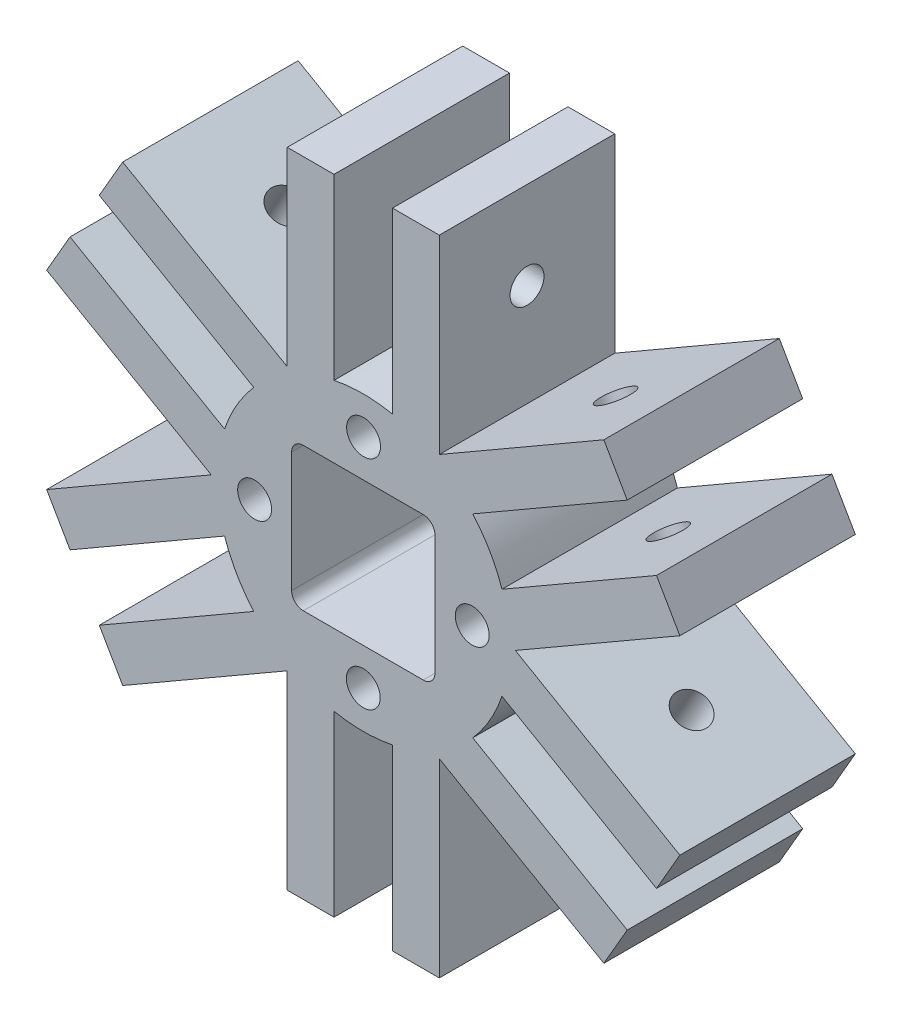
from build123d import *

# Parameters (mm, degrees)
SKETCH1_R           = 12.5
BOSS_EXTRUDE1_DEPTH = 7.5
SKETCH4_W           = 4
SKETCH4_H           = 27.5
BOSS_EXTRUDE3_DEPTH = 15
CIRPATTERN7_COUNT   = 6
SKETCH7_R           = 1.45
CUT_EXTRUDE2_DEPTH  = 17
CIRPATTERN9_COUNT   = 6
CUT_EXTRUDE3_REACH  = 43.398
SKETCH8_W           = 12.25
SKETCH8_H           = 12.25
SKETCH9_R           = 1.45
CUT_EXTRUDE4_DEPTH  = 10
FILLET1_R           = 1


with BuildPart() as part:
    # Sketch1 → Boss-Extrude1 (new, symmetric)
    with BuildSketch(Plane.XY):
        Circle(SKETCH1_R)
    extrude(amount=BOSS_EXTRUDE1_DEPTH, both=True)

    # Sketch4 → Boss-Extrude3 (add)
    with BuildSketch(Plane.XY.offset(7.5)):
        with Locations((-4.5, 13.75)):
            Rectangle(SKETCH4_W, SKETCH4_H)
        with Locations((4.5, 13.75)):
            Rectangle(SKETCH4_W, SKETCH4_H)
    boss_extrude3 = extrude(amount=-BOSS_EXTRUDE3_DEPTH)

    # CirPattern7: Boss-Extrude3 ×6 about axis
    cirpattern7_axis = Axis((0, 0, 0), (0, 0, 1))
    for i in range(1, CIRPATTERN7_COUNT):
        add(boss_extrude3.rotate(cirpattern7_axis, i * 360 / CIRPATTERN7_COUNT))

    # Sketch7 → Cut-Extrude2 (cut)
    with BuildSketch(Plane.ZY.offset(6.5)):
        with Locations((0, 20)):
            Circle(SKETCH7_R)
        with Locations((40, 20)):
            Circle(SKETCH7_R)
        with Locations((80, 20)):
            Circle(SKETCH7_R)
        with Locations((120, 20)):
            Circle(SKETCH7_R)
        with Locations((160, 20)):
            Circle(SKETCH7_R)
    cut_extrude2 = extrude(amount=-CUT_EXTRUDE2_DEPTH, mode=Mode.SUBTRACT)

    # CirPattern9: Cut-Extrude2 ×6 about axis
    cirpattern9_axis = Axis((0, 0, 0), (0, 0, 1))
    for i in range(1, CIRPATTERN9_COUNT):
        add(cut_extrude2.rotate(cirpattern9_axis, i * 360 / CIRPATTERN9_COUNT), mode=Mode.SUBTRACT)

    # Sketch8 → Cut-Extrude3 (cut, up to next)
    with BuildSketch(Plane.XY.offset(7.5), mode=Mode.PRIVATE) as cut_extrude3_sk1:
        Rectangle(SKETCH8_W, SKETCH8_H)
    cut_extrude3_tool1 = extrude(cut_extrude3_sk1.sketch, amount=-CUT_EXTRUDE3_REACH, mode=Mode.PRIVATE) & part.part
    add(cut_extrude3_tool1.solids().sort_by_distance((0, 0, 7.5))[0], mode=Mode.SUBTRACT)

    # Sketch9 → Cut-Extrude4 (cut)
    with BuildSketch(Plane.XY.offset(7.5)):
        with Locations((9.3125, 0)):
            Circle(SKETCH9_R)
        with Locations((0, -9.2875)):
            Circle(SKETCH9_R)
        with Locations((-9.2875, 0.025)):
            Circle(SKETCH9_R)
        with Locations((0.025, 9.3125)):
            Circle(SKETCH9_R)
    extrude(amount=-CUT_EXTRUDE4_DEPTH, mode=Mode.SUBTRACT)

    # Fillet1
    fillet1_edges = [part.edges().sort_by_distance(p)[0] for p in [
        (6.125, 6.125, 0),
        (6.125, -6.125, 0),
        (-6.125, -6.125, 0),
        (-6.125, 6.125, 0),
    ]]
    fillet(fillet1_edges, radius=FILLET1_R)


solid = part.part
